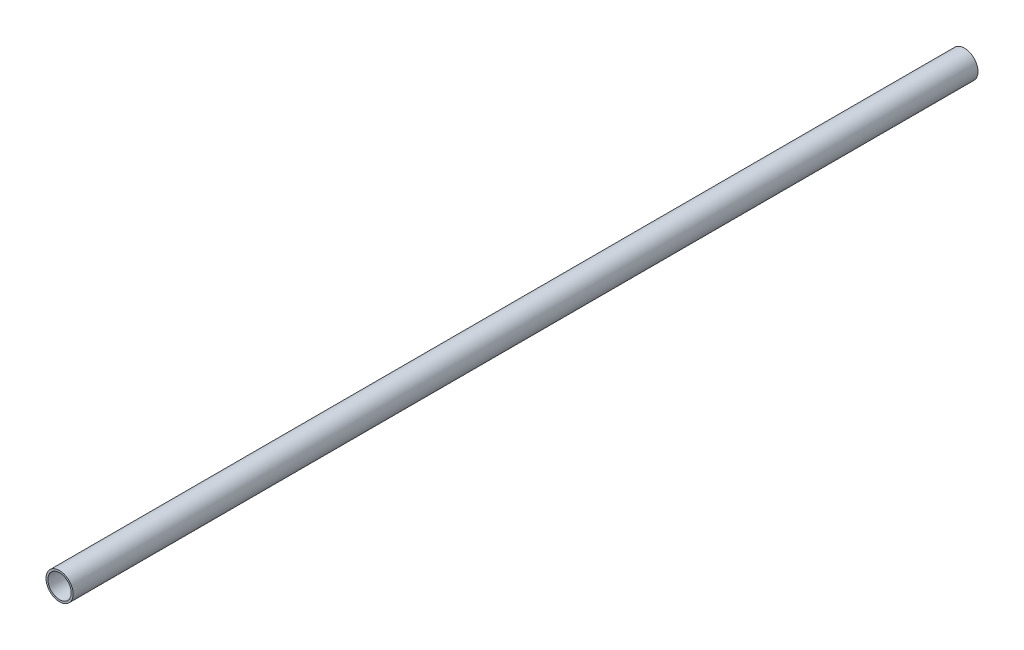
from build123d import *

# Parameters (mm, degrees)
CROQUIS1_R              = 1.8
CROQUIS1_R_2            = 1.55
SALIENTE_EXTRUIR1_DEPTH = 120


with BuildPart() as part:
    # Croquis1 → Saliente-Extruir1 (new body)
    with BuildSketch(Plane.XY):
        Circle(CROQUIS1_R)
        Circle(CROQUIS1_R_2, mode=Mode.SUBTRACT)
    extrude(amount=SALIENTE_EXTRUIR1_DEPTH)


solid = part.part
